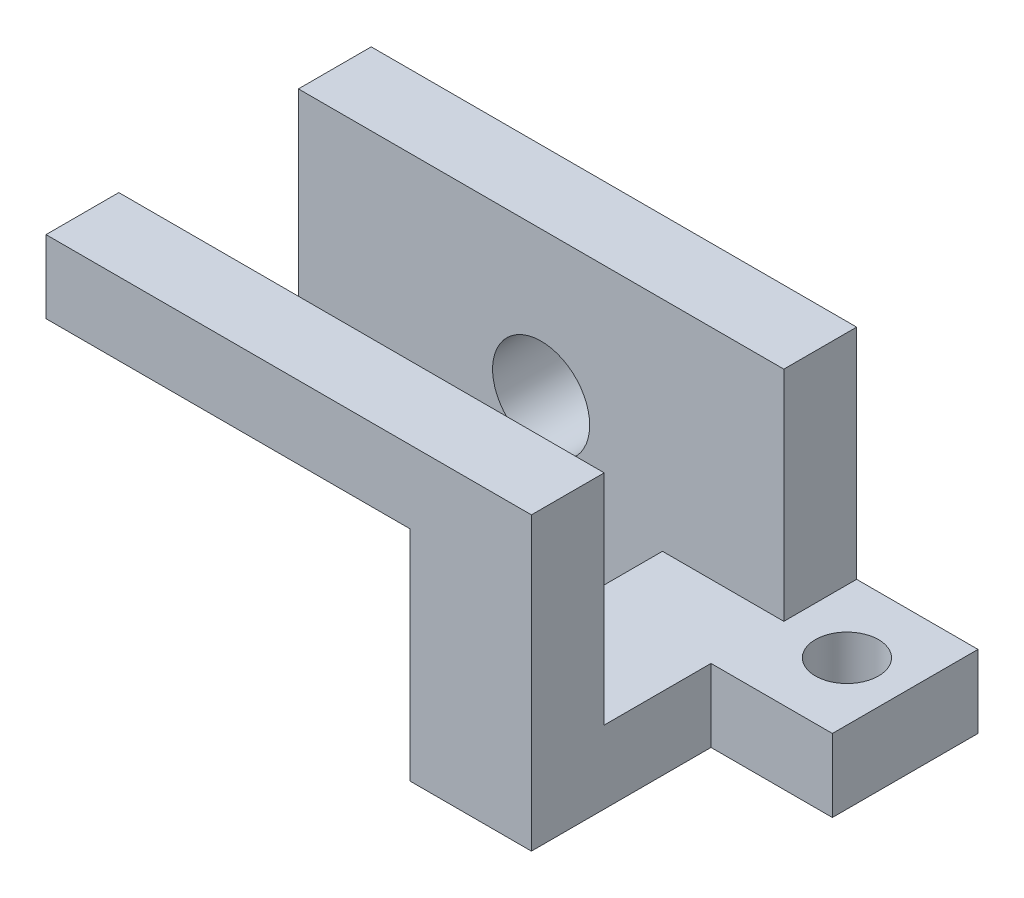
from build123d import *

# Parameters (mm, degrees)
SZKIC1_W                    = 100
SZKIC1_H                    = 60
SZKIC1_R                    = 10
DODANIE_WYCI_GNI_CIE1_DEPTH = 15
DODANIE_WYCI_GNI_CIE2_DEPTH = 15
SZKIC3_R                    = 6.5
DODANIE_WYCI_GNI_CIE5_DEPTH = 15


with BuildPart() as part:
    # Szkic1 → Dodanie-wyciągnięcie1 (new body)
    with BuildSketch(Plane.XY):
        Rectangle(SZKIC1_W, SZKIC1_H)
        Circle(SZKIC1_R, mode=Mode.SUBTRACT)
    extrude(amount=-DODANIE_WYCI_GNI_CIE1_DEPTH)



with BuildPart() as body_2:
    # Szkic2 → Dodanie-wyciągnięcie2 (new body)
    with BuildSketch(Plane.XY.offset(37)):
        Polygon((-50, 30), (-50, 15), (25, 15), (25, -30), (50, -30), (50, 30), align=None)
    extrude(amount=DODANIE_WYCI_GNI_CIE2_DEPTH)


with BuildPart() as part_1:
    add(part.part)

    add(body_2.part)  # Dodanie-wyciągnięcie5 merges body 2
    # Szkic3 → Dodanie-wyciągnięcie5 (add)
    with BuildSketch(Plane(origin=(0, -30, 0), x_dir=(-1, 0, 0), z_dir=(0, -1, 0))):
        Polygon((-25, 0), (-25, -37), (-50, -37), (-50, -15), (-75, -15), (-75, 15), (-50, 15), (-50, 0), align=None)
        with Locations(Location((-63, 0, 0), (0, 0, 90))):
            Circle(SZKIC3_R, mode=Mode.SUBTRACT)
    extrude(amount=-DODANIE_WYCI_GNI_CIE5_DEPTH)


solid = part_1.part
